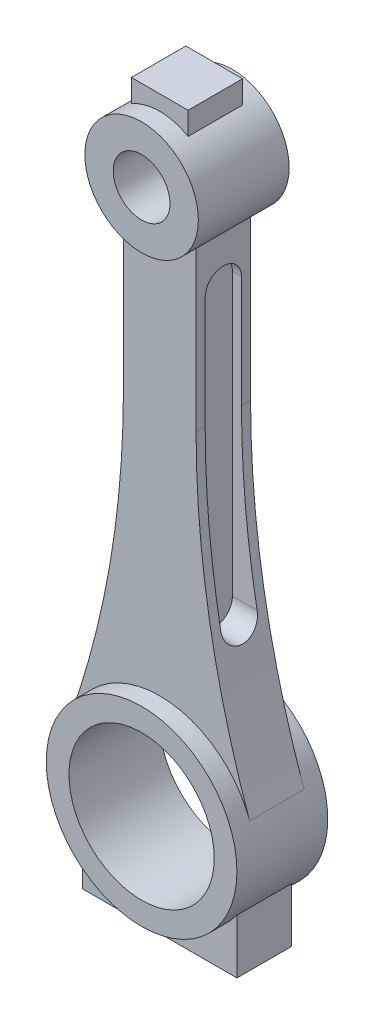
from build123d import *

# Parameters (mm, degrees)
SKETCH1_R             = 12.5
SKETCH1_R_2           = 6.25
BOSS_EXTRUDE1_DEPTH   = 10
SKETCH1_R_3           = 21
SKETCH1_R_4           = 16
BOSS_EXTRUDE1_2_DEPTH = 10
BOSS_EXTRUDE2_DEPTH   = 6
CUT_EXTRUDE1_START    = 6
CUT_EXTRUDE1_DEPTH    = 132.802456026


with BuildPart() as part:
    # Sketch1 → Boss-Extrude1 (new, symmetric)
    with BuildSketch(Plane.XY):
        with Locations((0, 120)):
            Circle(SKETCH1_R)
        with Locations((0, 120)):
            Circle(SKETCH1_R_2, mode=Mode.SUBTRACT)
    extrude(amount=BOSS_EXTRUDE1_DEPTH, both=True)



with BuildPart() as body_2:
    # Sketch1 → Boss-Extrude1 2 (new, symmetric)
    with BuildSketch(Plane.XY):
        Circle(SKETCH1_R_3)
        Circle(SKETCH1_R_4, mode=Mode.SUBTRACT)
    extrude(amount=BOSS_EXTRUDE1_2_DEPTH, both=True)


with BuildPart() as part_1:
    add(part.part)

    add(body_2.part)  # Boss-Extrude2 merges body 2
    # Sketch1<3> → Boss-Extrude2 (add, symmetric)
    with BuildSketch(Plane.XY):
        with BuildLine():
            Line((6.25, 135.825317547), (-6.25, 135.825317547))
            Line((-6.25, 135.825317547), (-6.25, 130.825317547))
            ThreePointArc((-6.25, 130.825317547), (0, 132.5), (6.25, 130.825317547))
            Line((6.25, 130.825317547), (6.25, 135.825317547))
        make_face()
        with BuildLine():
            Line((-8, 110.395313644), (-8, 75.395313644))
            ThreePointArc((-8, 75.395313644), (-10.96842855, 40.709642053), (-19.787382488, 7.032744434))
            ThreePointArc((-19.787382488, 7.032744434), (0, 21), (19.787382488, 7.032744434))
            ThreePointArc((19.787382488, 7.032744434), (10.96842855, 40.709642053), (8, 75.395313644))
            Line((8, 75.395313644), (8, 110.395313644))
            ThreePointArc((8, 110.395313644), (0, 107.5), (-8, 110.395313644))
        make_face()
        with BuildLine():
            Line((-17, -12.328828006), (-17, -24.328828006))
            Line((-17, -24.328828006), (17, -24.328828006))
            Line((17, -24.328828006), (17, -12.328828006))
            ThreePointArc((17, -12.328828006), (0, -21), (-17, -12.328828006))
        make_face()
    extrude(amount=BOSS_EXTRUDE2_DEPTH, both=True)

    # Sketch2 → Cut-Extrude1 (cut, through all)
    with BuildSketch(Plane(origin=(0, 0, 0), x_dir=(0, 0, -1), z_dir=(1, 0, 0)).offset(CUT_EXTRUDE1_START)):
        with BuildLine():
            Line((4, 100), (4, 38))
            ThreePointArc((4, 38), (0, 34), (-4, 38))
            Line((-4, 38), (-4, 100))
            ThreePointArc((-4, 100), (0, 104), (4, 100))
        make_face()
    cut_extrude1 = extrude(amount=CUT_EXTRUDE1_DEPTH, mode=Mode.SUBTRACT)

    # Mirror1: Cut-Extrude1 across plane
    add(cut_extrude1.mirror(Plane(origin=(0, 0, 0), x_dir=(0, 0, 1), z_dir=(1, 0, 0))), mode=Mode.SUBTRACT)


solid = part_1.part
